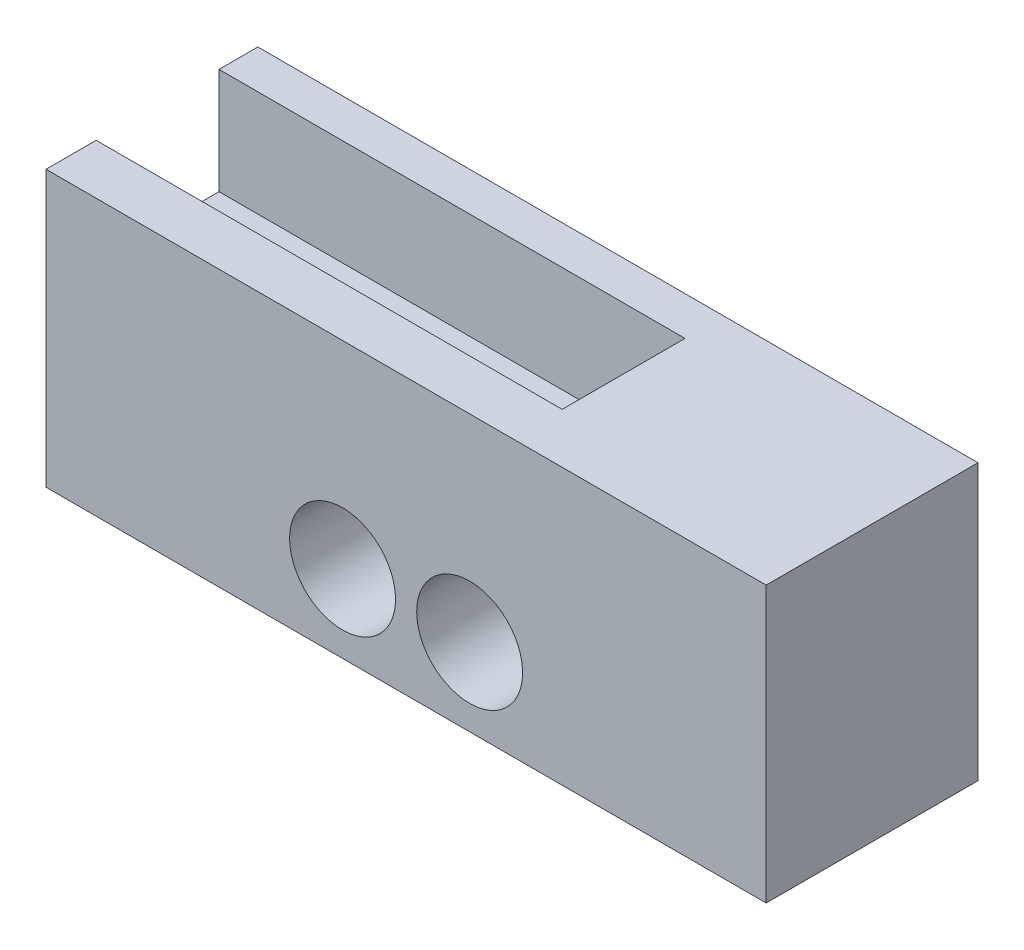
from build123d import *

# Parameters (mm, degrees)
SKETCH_1_W          = 34
SKETCH_1_H          = 10
EXTRUDE_2_DEPTH     = 13
SKETCH_2_W          = 22
SKETCH_2_H          = 5.8
CUT_EXTRUDE_1_DEPTH = 5
SKETCH_3_R          = 2.5
CUT_EXTRUDE_2_DEPTH = 20


with BuildPart() as part:
    # 草圖1 → 填料-伸長2 (new body)
    with BuildSketch(Plane(origin=(0, 0, 0), x_dir=(1, 0, 0), z_dir=(0, 1, 0))):
        with Locations((0.708333333, 1.1625)):
            Rectangle(SKETCH_1_W, SKETCH_1_H)
    extrude(amount=EXTRUDE_2_DEPTH)

    # 草圖2 → 除料-伸長1 (cut)
    with BuildSketch(Plane(origin=(0, 13, 0), x_dir=(1, 0, 0), z_dir=(0, 1, 0))):
        with Locations((-5.291666667, 1.430875321)):
            Rectangle(SKETCH_2_W, SKETCH_2_H)
    extrude(amount=-CUT_EXTRUDE_1_DEPTH, mode=Mode.SUBTRACT)

    # 草圖3 → 除料-伸長2 (cut)
    with BuildSketch(Plane(origin=(0, 0, -6.1625), x_dir=(-1, 0, 0), z_dir=(0, 0, -1))):
        with Locations((2.291666667, 3.663194133)):
            Circle(SKETCH_3_R)
        with Locations((-3.708333333, 3.663194133)):
            Circle(SKETCH_3_R)
    extrude(amount=-CUT_EXTRUDE_2_DEPTH, mode=Mode.SUBTRACT)


solid = part.part
